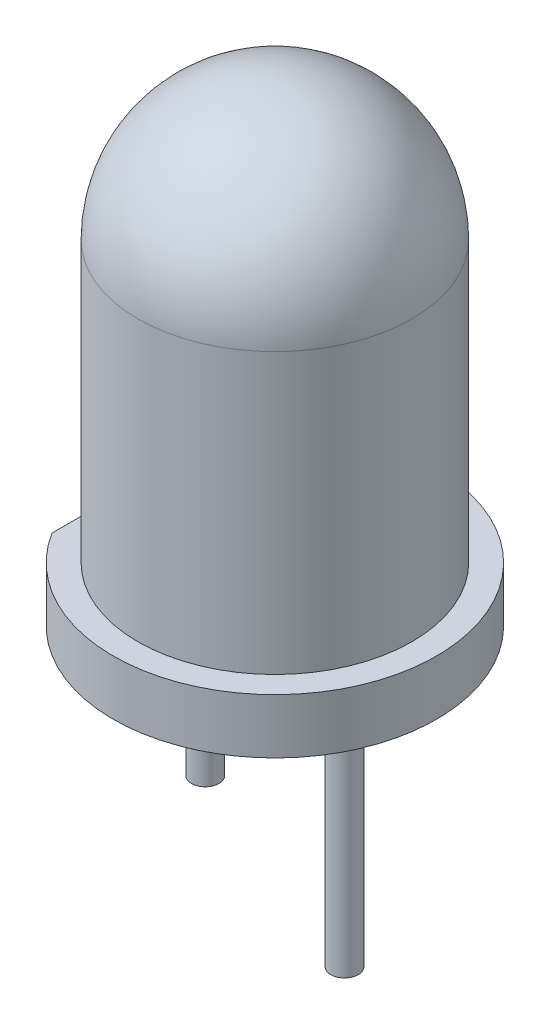
from build123d import *

# Parameters (mm, degrees)
SKETCH1_R           = 2.95
BOSS_EXTRUDE1_DEPTH = 1
SKETCH2_R           = 2.5
BOSS_EXTRUDE2_DEPTH = 7.6
FILLET1_R           = 2.5
SKETCH3_R           = 0.25
BOSS_EXTRUDE3_DEPTH = 4.75
CUT_EXTRUDE1_START  = -1.75
SKETCH4_R           = 0.25
CUT_EXTRUDE1_DEPTH  = 1.75
CUT_EXTRUDE2_DEPTH  = 9.669775084


with BuildPart() as part:
    # Sketch1 → Boss-Extrude1 (new body)
    with BuildSketch(Plane(origin=(0, 0, 0), x_dir=(1, 0, 0), z_dir=(0, 1, 0))):
        with Locations(Location((0, 0, 0), (0, 0, 270))):
            Circle(SKETCH1_R)
    extrude(amount=BOSS_EXTRUDE1_DEPTH)

    # Sketch2 → Boss-Extrude2 (add)
    with BuildSketch(Plane(origin=(0, 1, 0), x_dir=(1, 0, 0), z_dir=(0, 1, 0))):
        with Locations(Location((0, 0, 0), (0, 0, 90))):
            Circle(SKETCH2_R)
    extrude(amount=BOSS_EXTRUDE2_DEPTH)

    # Fillet1
    fillet1_edges = [part.edges().sort_by_distance(p)[0] for p in [
        (0, 8.6, 2.5),
    ]]
    fillet(fillet1_edges, radius=FILLET1_R)

    # Sketch3 → Boss-Extrude3 (add)
    with BuildSketch(Plane.XZ):
        with Locations(Location((-1.27, 0, 0), (0, 0, 90))):
            Circle(SKETCH3_R)
        with Locations(Location((1.27, 0, 0), (0, 0, 90))):
            Circle(SKETCH3_R)
    extrude(amount=BOSS_EXTRUDE3_DEPTH)

    # Sketch4 → Cut-Extrude1 (cut)
    with BuildSketch(Plane.XZ.offset(4.75).offset(CUT_EXTRUDE1_START)):
        with Locations(Location((-1.27, 0, 0), (0, 0, 90))):
            Circle(SKETCH4_R)
    extrude(amount=CUT_EXTRUDE1_DEPTH, mode=Mode.SUBTRACT)

    # Sketch5 → Cut-Extrude2 (cut, through all)
    with BuildSketch(Plane(origin=(0, 1, 0), x_dir=(1, 0, 0), z_dir=(0, 1, 0))):
        Polygon((-2.5, 0), (-2.5, 1.983520803), (-3.125999015, 1.983520803), (-3.125999015, 0), (-3.125999015, -2.184477883), (-2.5, -2.184477883), align=None)
    extrude(amount=-CUT_EXTRUDE2_DEPTH, mode=Mode.SUBTRACT)


solid = part.part
